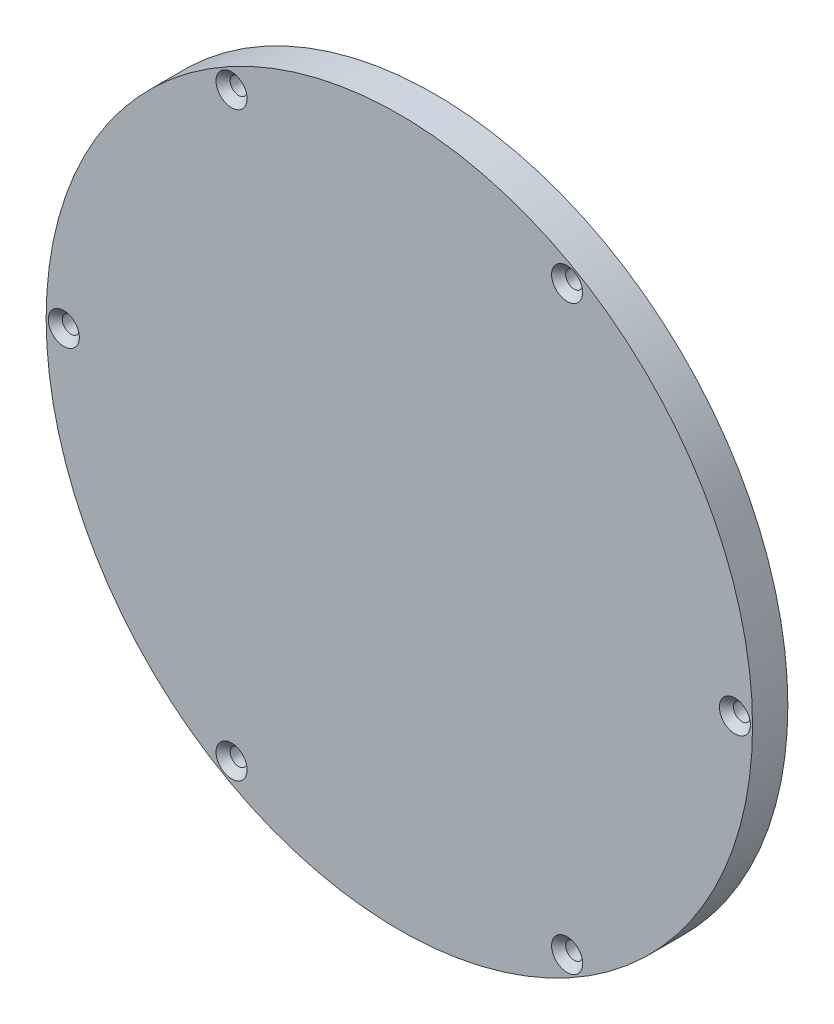
from build123d import *

# Parameters (mm, degrees)
SKETCH1_R                                       = 50
BOSS_EXTRUDE1_DEPTH                             = 5
SKETCH3_R                                       = 3
CUT_EXTRUDE2_DEPTH                              = 4
CSK_FOR_M2_FLAT_HEAD_MACHINE_SCREW1_D           = 2.4
CSK_FOR_M2_FLAT_HEAD_MACHINE_SCREW1_CSINK_D     = 4.4
CSK_FOR_M2_FLAT_HEAD_MACHINE_SCREW1_CSINK_ANGLE = 90
CIRPATTERN1_COUNT                               = 6


with BuildPart() as part:
    # Sketch1 → Boss-Extrude1 (new body)
    with BuildSketch(Plane.XY):
        Circle(SKETCH1_R)
    extrude(amount=BOSS_EXTRUDE1_DEPTH)

    # Sketch3 → Cut-Extrude2 (cut)
    with BuildSketch(Plane(origin=(0, 0, 0), x_dir=(-1, 0, 0), z_dir=(0, 0, -1))):
        Circle(SKETCH3_R)
    extrude(amount=-CUT_EXTRUDE2_DEPTH, mode=Mode.SUBTRACT)

    # CSK for M2 Flat Head Machine Screw1 (through all)
    with Locations(Plane(origin=(-47.5, 0, 5), x_dir=(1, 0, 0), z_dir=(0, 0, 1))):
        with Locations((0, 0)):
            csk_for_m2_flat_head_machine_screw1 = CounterSinkHole(CSK_FOR_M2_FLAT_HEAD_MACHINE_SCREW1_D / 2, CSK_FOR_M2_FLAT_HEAD_MACHINE_SCREW1_CSINK_D / 2, counter_sink_angle=CSK_FOR_M2_FLAT_HEAD_MACHINE_SCREW1_CSINK_ANGLE)

    # CirPattern1: CSK for M2 Flat Head Machine Screw1 ×6 about axis
    cirpattern1_axis = Axis((0, 0, 0), (0, 0, 1))
    for i in range(1, CIRPATTERN1_COUNT):
        add(csk_for_m2_flat_head_machine_screw1.rotate(cirpattern1_axis, i * 360 / CIRPATTERN1_COUNT), mode=Mode.SUBTRACT)


solid = part.part
